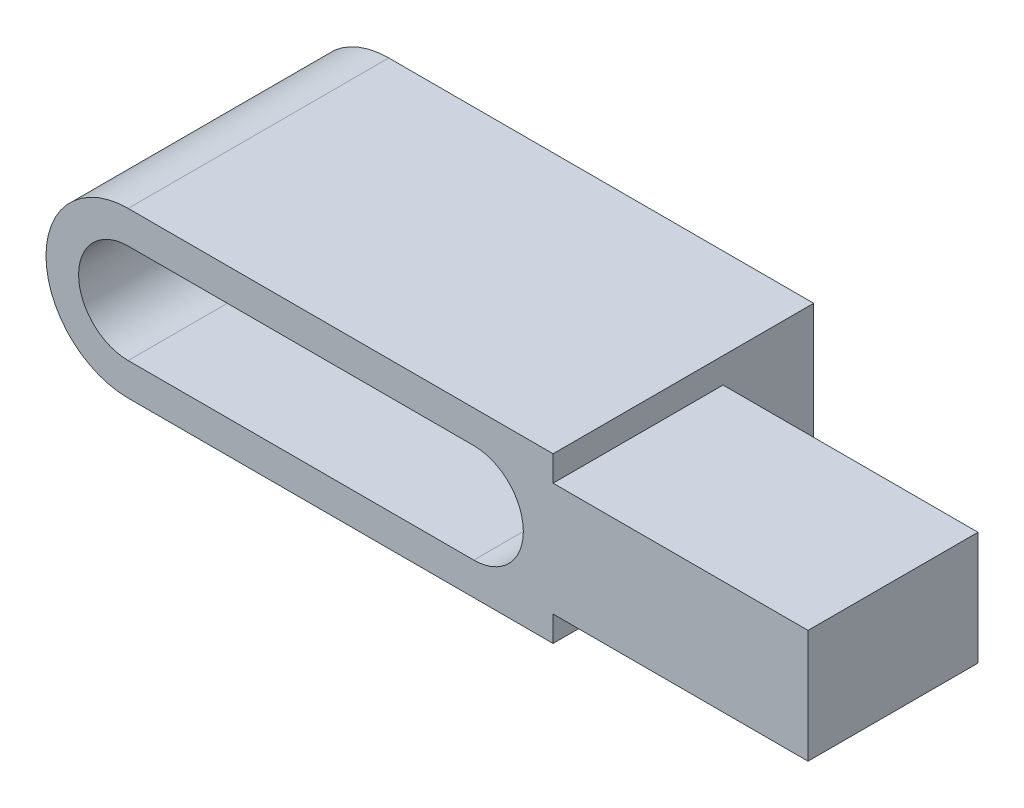
from build123d import *

# Parameters (mm, degrees)
EXTRUDE_1_DEPTH     = 3.2
EXTRUDE_2_DEPTH     = 6
CUT_EXTRUDE_1_DEPTH = 26.866000851


with BuildPart() as part:
    # Эскиз1 → Бобышка-Вытянуть1 (new body)
    with BuildSketch(Plane.XY):
        with BuildLine():
            Line((0, 2.9), (15, 2.9))
            Line((15, 2.9), (15, -2.9))
            Line((15, -2.9), (0, -2.9))
            ThreePointArc((0, -2.9), (-2.9, 0), (0, 2.9))
        make_face()
    extrude(amount=EXTRUDE_1_DEPTH)

    # Эскиз2 → Бобышка-Вытянуть2 (add)
    with BuildSketch(Plane.XY.offset(3.2)):
        with BuildLine():
            Line((24, 2), (24, -2))
            Line((24, -2), (15, -2))
            Line((15, -2), (15, -2.9))
            Line((15, -2.9), (0, -2.9))
            ThreePointArc((0, -2.9), (-2.9, 0), (0, 2.9))
            Line((0, 2.9), (15, 2.9))
            Line((15, 2.9), (15, 2))
            Line((15, 2), (24, 2))
        make_face()
    extrude(amount=EXTRUDE_2_DEPTH)

    # Эскиз3 → Вырез-Вытянуть1 (cut, through all)
    with BuildSketch(Plane.XY.offset(9.2)):
        with BuildLine():
            Line((0, 1.75), (12.2, 1.75))
            ThreePointArc((12.2, 1.75), (13.95, 0), (12.2, -1.75))
            Line((12.2, -1.75), (0, -1.75))
            ThreePointArc((0, -1.75), (-1.75, 0), (0, 1.75))
        make_face()
    extrude(amount=-CUT_EXTRUDE_1_DEPTH, mode=Mode.SUBTRACT)


solid = part.part
